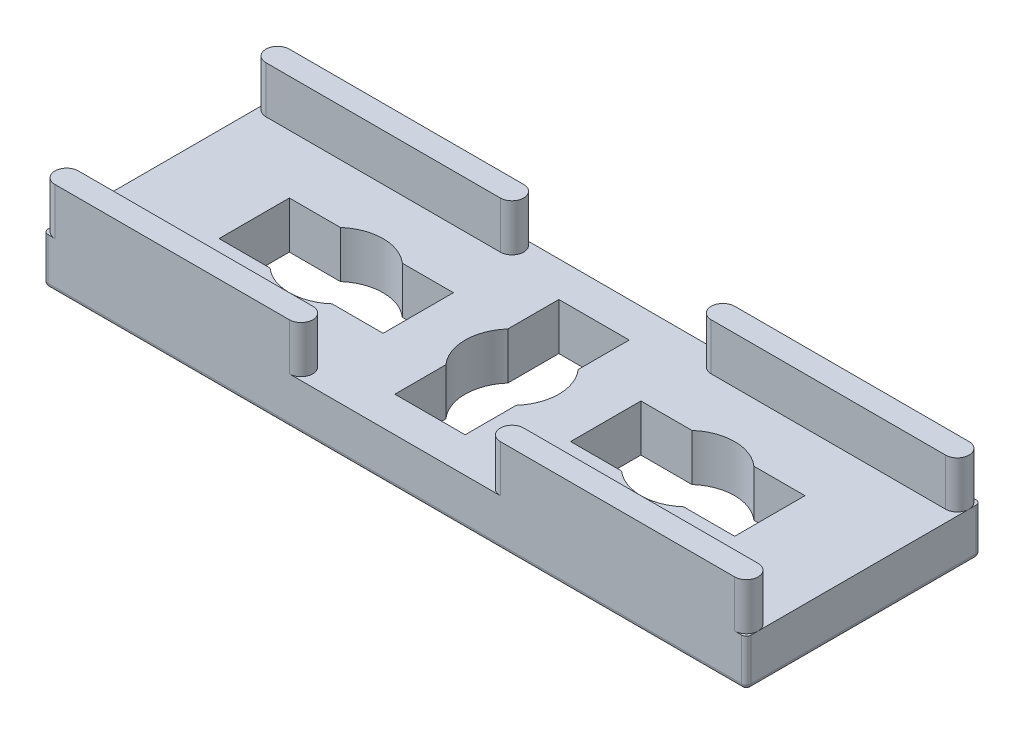
from build123d import *

# Parameters (mm, degrees)
SKETCH_1_W            = 30
SKETCH_1_H            = 10
EXTRUDE_1_DEPTH       = 2
EXTRUDE_2_DEPTH       = 2
MIRROR_2_COPY_1_DEPTH = 2
CUT_EXTRUDE_1_REACH   = 17.937
CUT_EXTRUDE_2_REACH   = 17.937
FILLET_1_R            = 0.2


with BuildPart() as part:
    # 草图1 → 凸台-拉伸1 (new body)
    with BuildSketch(Plane(origin=(0, 0, 0), x_dir=(1, 0, 0), z_dir=(0, 1, 0))):
        Rectangle(SKETCH_1_W, SKETCH_1_H)
    extrude(amount=EXTRUDE_1_DEPTH)

    # 草图2 → 凸台-拉伸2 (add)
    with BuildSketch(Plane(origin=(0, 2, 0), x_dir=(1, 0, 0), z_dir=(0, 1, 0))):
        with BuildLine():
            Line((-14.5, 4), (-4.5, 4))
            ThreePointArc((-4.5, 4), (-4, 4.5), (-4.5, 5))
            Line((-4.5, 5), (-14.5, 5))
            ThreePointArc((-14.5, 5), (-15, 4.5), (-14.5, 4))
        make_face()
    extrude_2 = extrude(amount=EXTRUDE_2_DEPTH)

    # 镜向1: 凸台-拉伸2 across plane
    add(extrude_2.mirror(Plane.XY))

    # 镜向2: 凸台-拉伸2 across plane
    add(extrude_2.mirror(Plane(origin=(0, 0, 0), x_dir=(0, 0, 1), z_dir=(1, 0, 0))))

    # 镜向2 copy 1 sketch → 镜向2 copy 1 (add)
    with BuildSketch(Plane(origin=(0, 2, 0), x_dir=(-1, 0, 0), z_dir=(0, 1, 0))):
        with BuildLine():
            Line((-14.5, 4), (-4.5, 4))
            ThreePointArc((-4.5, 4), (-4, 4.5), (-4.5, 5))
            Line((-4.5, 5), (-14.5, 5))
            ThreePointArc((-14.5, 5), (-15, 4.5), (-14.5, 4))
        make_face()
    extrude(amount=MIRROR_2_COPY_1_DEPTH)

    # 草图3 → 切除-拉伸1 (cut, up to next)
    with BuildSketch(Plane(origin=(0, 2, 0), x_dir=(1, 0, 0), z_dir=(0, 1, 0)), mode=Mode.PRIVATE) as cut_extrude_1_sk1:
        with BuildLine():
            Line((1.5, -3.5), (-1.5, -3.5))
            Line((-1.5, -3.5), (-1.5, -1.322875656))
            ThreePointArc((-1.5, -1.322875656), (-2, 0), (-1.5, 1.322875656))
            Line((-1.5, 1.322875656), (-1.5, 3.5))
            Line((-1.5, 3.5), (1.5, 3.5))
            Line((1.5, 3.5), (1.5, 1.322875656))
            ThreePointArc((1.5, 1.322875656), (2, 0), (1.5, -1.322875656))
            Line((1.5, -1.322875656), (1.5, -3.5))
        make_face()
    cut_extrude_1_tool1 = extrude(cut_extrude_1_sk1.sketch, amount=-CUT_EXTRUDE_1_REACH, mode=Mode.PRIVATE) & part.part
    add(cut_extrude_1_tool1.solids().sort_by_distance((0, 2, 0))[0], mode=Mode.SUBTRACT)

    # 草图4 → 切除-拉伸2 (cut, up to next)
    with BuildSketch(Plane(origin=(0, 2, 0), x_dir=(1, 0, 0), z_dir=(0, 1, 0)), mode=Mode.PRIVATE) as cut_extrude_2_sk1:
        with BuildLine():
            Line((-4, 1.5), (-4, -1.5))
            Line((-4, -1.5), (-6.177124344, -1.5))
            ThreePointArc((-6.177124344, -1.5), (-7.5, -2), (-8.822875656, -1.5))
            Line((-8.822875656, -1.5), (-11, -1.5))
            Line((-11, -1.5), (-11, 1.5))
            Line((-11, 1.5), (-8.822875656, 1.5))
            ThreePointArc((-8.822875656, 1.5), (-7.5, 2), (-6.177124344, 1.5))
            Line((-6.177124344, 1.5), (-4, 1.5))
        make_face()
    cut_extrude_2_tool1 = extrude(cut_extrude_2_sk1.sketch, amount=-CUT_EXTRUDE_2_REACH, mode=Mode.PRIVATE) & part.part
    cut_extrude_2 = cut_extrude_2_tool1.solids().sort_by_distance((-7.5, 2, 0))[0]
    add(cut_extrude_2, mode=Mode.SUBTRACT)

    # 镜向3: 切除-拉伸2 across plane
    add(cut_extrude_2.mirror(Plane(origin=(0, 0, 0), x_dir=(0, 0, 1), z_dir=(1, 0, 0))), mode=Mode.SUBTRACT)

    # 圆角1
    fillet_1_edges = [part.edges().sort_by_distance(p)[0] for p in [
        (0, 0, 5),
        (-15, 1, 5),
        (-15, 0, 0),
        (-15, 1, -5),
        (0, 0, -5),
        (15, 0, 0),
        (15, 1, -5),
        (15, 1, 5),
    ]]
    fillet(fillet_1_edges, radius=FILLET_1_R)


solid = part.part
